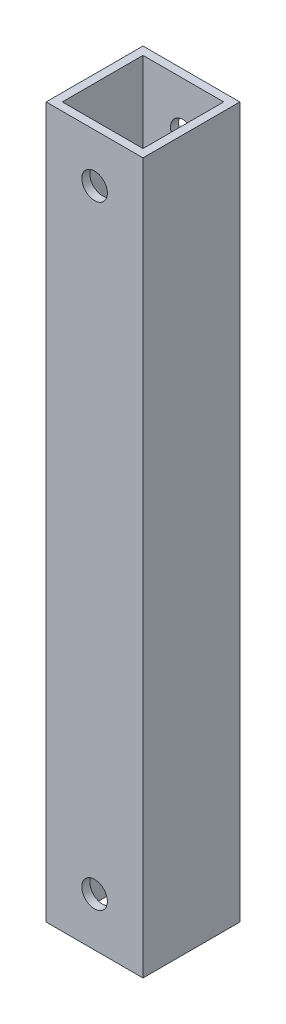
from build123d import *

# Parameters (mm, degrees)
SKETCH1_W                = 38.1
SKETCH1_H                = 38.1
SKETCH1_W_2              = 31.75
SKETCH1_H_2              = 31.75
BOSS_EXTRUDE1_DEPTH      = 279.4
X_0_397_DIAMETER_HOLE1_D = 10.0838


with BuildPart() as part:
    # Sketch1 → Boss-Extrude1 (new body)
    with BuildSketch(Plane(origin=(0, 0, 0), x_dir=(1, 0, 0), z_dir=(0, 1, 0))):
        with Locations((19.05, 19.05)):
            Rectangle(SKETCH1_W, SKETCH1_H)
        with Locations((19.05, 19.05)):
            Rectangle(SKETCH1_W_2, SKETCH1_H_2, mode=Mode.SUBTRACT)
    extrude(amount=BOSS_EXTRUDE1_DEPTH)

    # X (0.397) Diameter Hole1 (through all)
    with Locations(Plane.XY):
        with Locations((19.05, 260.35), (19.05, 19.05)):
            Hole(X_0_397_DIAMETER_HOLE1_D / 2)


solid = part.part
